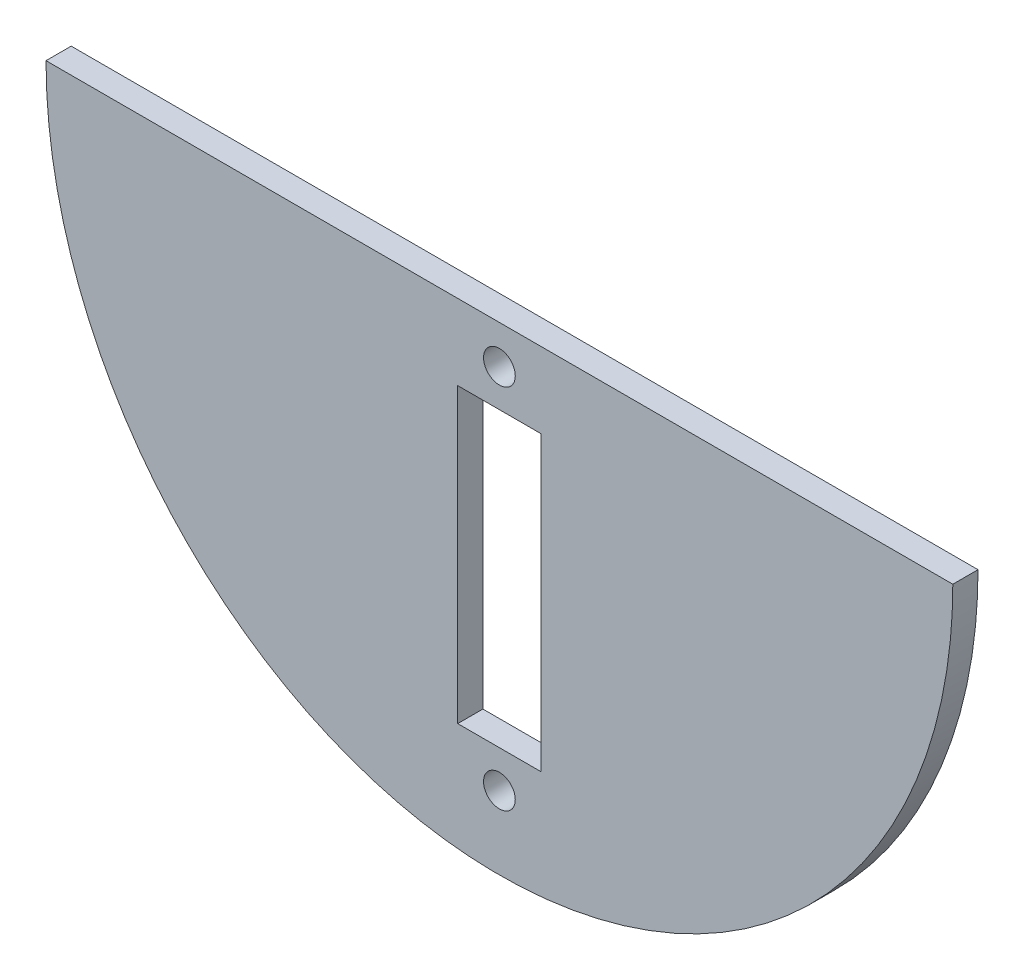
from build123d import *

# Parameters (mm, degrees)
SKETCH1_R           = 1.59999934
SKETCH1_W           = 8.4074
SKETCH1_H           = 29.5148
BOSS_EXTRUDE1_DEPTH = 2.54


with BuildPart() as part:
    # Sketch1 → Boss-Extrude1 (new body)
    with BuildSketch(Plane.XY):
        with BuildLine():
            Line((-149.141343613, 133.262997238), (-57.701343613, 133.262997238))
            add(Edge.make_bspline(
                [(-149.141343613, 133.262997238), (-149.141343613, 85.002997238), (-103.421343613, 85.002997238), (-57.701343613, 85.002997238), (-57.701343613, 133.262997238)],
                knots=[1.570796327, 1.570796327, 1.570796327, 3.141592654, 3.141592654, 4.71238898, 4.71238898, 4.71238898], degree=2, weights=[1, 0.707106781, 1, 0.707106781, 1]))
        make_face()
        with Locations((-103.421343613, 129.392997358)):
            Circle(SKETCH1_R, mode=Mode.SUBTRACT)
        with Locations((-103.421343613, 92.378197118)):
            Circle(SKETCH1_R, mode=Mode.SUBTRACT)
        with Locations((-103.421343613, 110.885597238)):
            Rectangle(SKETCH1_W, SKETCH1_H, mode=Mode.SUBTRACT)
    extrude(amount=BOSS_EXTRUDE1_DEPTH)


solid = part.part
